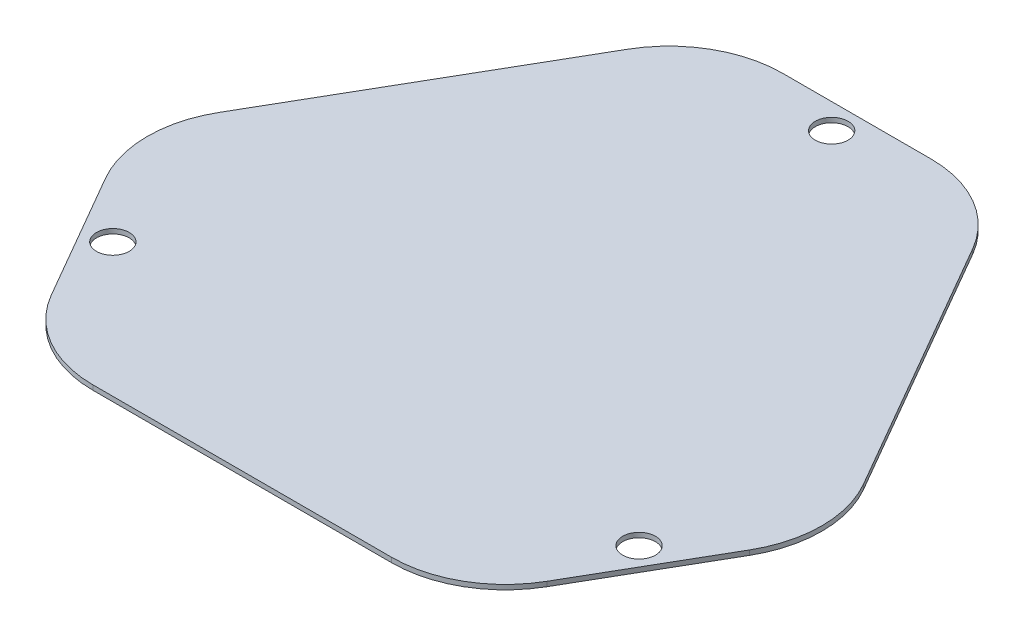
from build123d import *

# Parameters (mm, degrees)
SKETCH3_R           = 21.082
BOSS_EXTRUDE1_DEPTH = 6.35
CUT_EXTRUDE1_DEPTH  = 722.250266796
FILLET1_R           = 152.4
SKETCH5_R           = 21.971
CUT_EXTRUDE2_DEPTH  = 632.548321209


with BuildPart() as part:
    # Sketch3 → Boss-Extrude1 (new body)
    with BuildSketch(Plane(origin=(0, 0, 0), x_dir=(1, 0, 0), z_dir=(0, 1, 0))):
        Polygon((-534.293160191, 43.478424236), (-229.493160191, -484.450661911), (229.493160191, -484.450661911), (534.293160191, 43.478424236), (304.8, 440.972237675), (-304.8, 440.972237675), align=None)
        with Locations(Location((-352.63709, -203.595118838, 0), (0, 0, 270))):
            Circle(SKETCH3_R, mode=Mode.SUBTRACT)
        with Locations(Location((352.63709, -203.595118838, 0), (0, 0, 270))):
            Circle(SKETCH3_R, mode=Mode.SUBTRACT)
        with Locations(Location((0, 407.190237675, 0), (0, 0, 270))):
            Circle(SKETCH3_R, mode=Mode.SUBTRACT)
    extrude(amount=BOSS_EXTRUDE1_DEPTH)

    # Sketch4 → Cut-Extrude1 (cut, through all)
    with BuildSketch(Plane(origin=(0, 6.35, 0), x_dir=(1, 0, 0), z_dir=(0, 1, 0))):
        Polygon((-187.482425301, 440.972237675), (-475.634372841, -58.121575764), (-534.293160191, 43.478424236), (-304.8, 440.972237675), align=None)
        Polygon((304.8, 440.972237675), (534.293160191, 43.478424236), (475.634372841, -58.121575764), (187.482425301, 440.972237675), align=None)
        Polygon((229.493160191, -484.450661911), (-229.493160191, -484.450661911), (-288.15194754, -382.850661911), (288.15194754, -382.850661911), align=None)
    extrude(amount=-CUT_EXTRUDE1_DEPTH, mode=Mode.SUBTRACT)

    # Fillet1
    fillet1_edges = [part.edges().sort_by_distance(p)[0] for p in [
        (288.15194754, 3.175, 382.850661911),
        (-288.15194754, 3.175, 382.850661911),
        (187.482425301, 3.175, -440.972237675),
        (475.634372841, 3.175, 58.121575764),
        (-187.482425301, 3.175, -440.972237675),
        (-475.634372841, 3.175, 58.121575764),
    ]]
    fillet(fillet1_edges, radius=FILLET1_R)

    # Sketch5 → Cut-Extrude2 (cut, through all)
    with BuildSketch(Plane(origin=(0, 6.35, 0), x_dir=(1, 0, 0), z_dir=(0, 1, 0))):
        with Locations(Location((0, 407.190237675, 0), (0, 0, 270))):
            Circle(SKETCH5_R)
        with Locations(Location((352.63709, -203.595118838, 0), (0, 0, 270))):
            Circle(SKETCH5_R)
        with Locations(Location((-352.63709, -203.595118838, 0), (0, 0, 270))):
            Circle(SKETCH5_R)
    extrude(amount=-CUT_EXTRUDE2_DEPTH, mode=Mode.SUBTRACT)


solid = part.part
